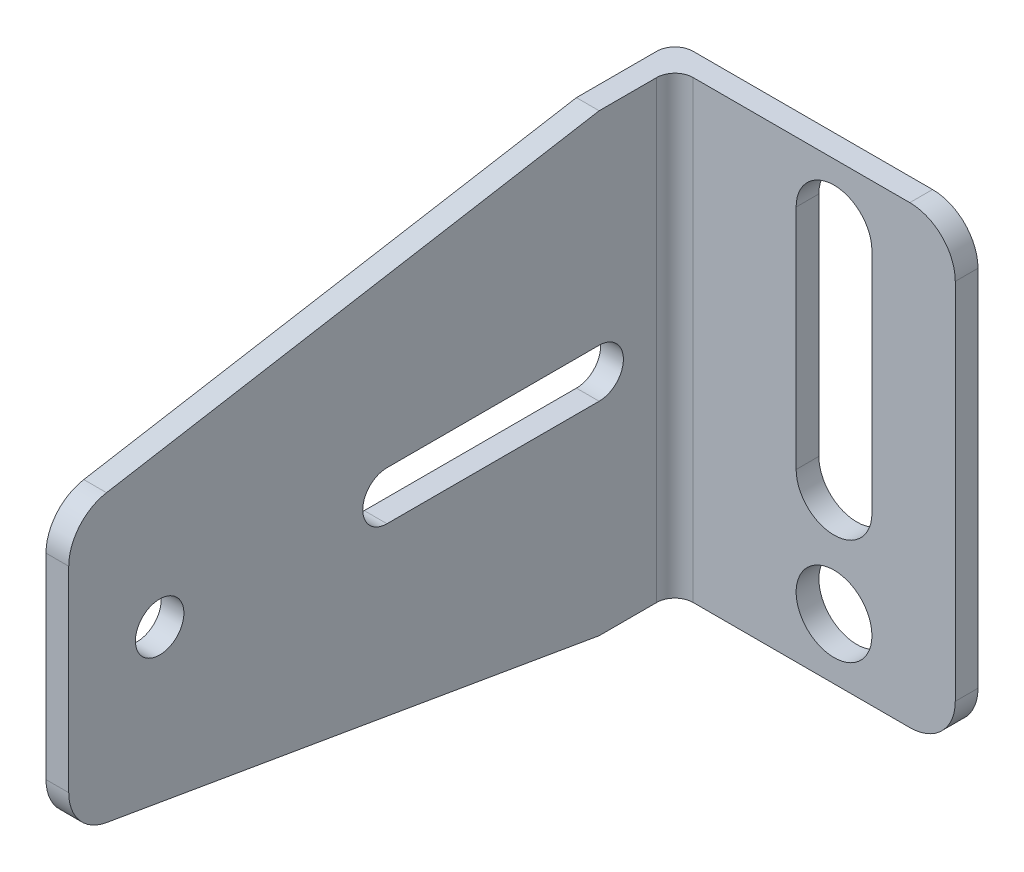
from build123d import *

# Parameters (mm, degrees)
SKETCH1_W           = 20
SKETCH1_H           = 30
SKETCH1_R           = 2.5
BOSS_EXTRUDE1_DEPTH = 1.5
SKETCH3_R           = 1.6
BOSS_EXTRUDE2_DEPTH = 1.5
FILLET1_R           = 1.2
FILLET2_R           = 3


with BuildPart() as part:
    # Sketch1 → Boss-Extrude1 (new body)
    with BuildSketch(Plane.XY):
        with Locations((10, -15)):
            Rectangle(SKETCH1_W, SKETCH1_H)
        with Locations((12, -26)):
            Circle(SKETCH1_R, mode=Mode.SUBTRACT)
        with BuildLine():
            Line((14.5, -4), (14.5, -19))
            ThreePointArc((14.5, -19), (12, -21.5), (9.5, -19))
            Line((9.5, -19), (9.5, -4))
            ThreePointArc((9.5, -4), (12, -1.5), (14.5, -4))
        make_face(mode=Mode.SUBTRACT)
    extrude(amount=BOSS_EXTRUDE1_DEPTH)

    # Sketch3 → Boss-Extrude2 (add)
    with BuildSketch(Plane.ZY):
        Polygon((1.5, 0), (1.5, -30), (6.5, -30), (41.5, -24), (41.5, -6), (6.5, 0), align=None)
        with Locations(Location((35.5, -15, 0), (0, 0, 270))):
            Circle(SKETCH3_R, mode=Mode.SUBTRACT)
        with BuildLine():
            Line((6.5, -13.4), (20.5, -13.4))
            ThreePointArc((20.5, -13.4), (22.1, -15), (20.5, -16.6))
            Line((20.5, -16.6), (6.5, -16.6))
            ThreePointArc((6.5, -16.6), (4.9, -15), (6.5, -13.4))
        make_face(mode=Mode.SUBTRACT)
    extrude(amount=-BOSS_EXTRUDE2_DEPTH)

    # Fillet1
    fillet1_edges = [part.edges().sort_by_distance(p)[0] for p in [
        (1.5, -15, 1.5),
        (0, -15, 0),
    ]]
    fillet(fillet1_edges, radius=FILLET1_R)

    # Fillet2
    fillet2_edges = [part.edges().sort_by_distance(p)[0] for p in [
        (0.75, -6, 41.5),
        (0.75, -24, 41.5),
        (20, 0, 0.75),
        (20, -30, 0.75),
    ]]
    fillet(fillet2_edges, radius=FILLET2_R)


solid = part.part
